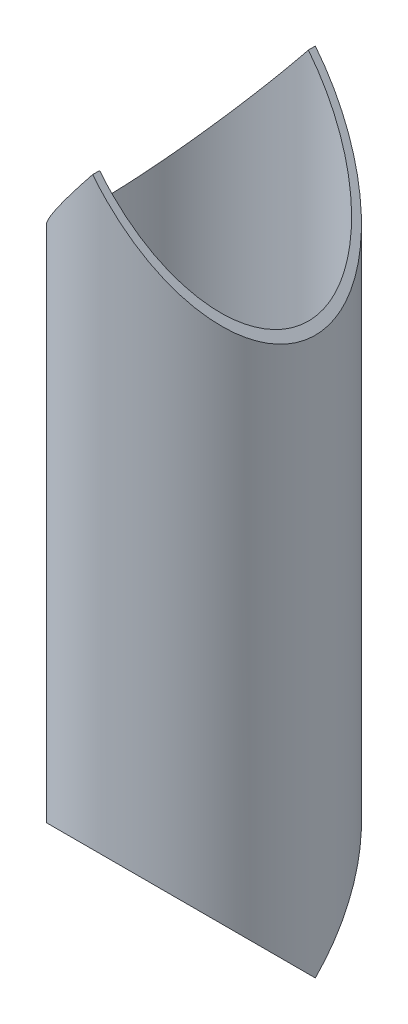
from build123d import *

# Parameters (mm, degrees)
SKETCH1_R               = 25.4
SKETCH1_R_2             = 23.8125
BOSS_EXTRUDE1_DEPTH     = 158.75
CUT_EXTRUDE1_DEPTH      = 163.763271348
CUT_EXTRUDE1_DEPTH_BACK = 163.763271348
CUT_EXTRUDE2_DEPTH      = 163.763271348
CUT_EXTRUDE2_DEPTH_BACK = 163.763271348


with BuildPart() as part:
    # Sketch1 → Boss-Extrude1 (new body)
    with BuildSketch(Plane(origin=(0, 0, 0), x_dir=(1, 0, 0), z_dir=(0, 1, 0))):
        with Locations(Location((0, 0, 0), (0, 0, 90))):
            Circle(SKETCH1_R)
        with Locations(Location((0, 0, 0), (0, 0, 90))):
            Circle(SKETCH1_R_2, mode=Mode.SUBTRACT)
    extrude(amount=BOSS_EXTRUDE1_DEPTH)

    # Sketch2 → Cut-Extrude1 (cut, two sides: drawn at the far end of the back side and taken through both)
    with BuildSketch(Plane.XY.offset(-CUT_EXTRUDE1_DEPTH_BACK)):
        Polygon((25.4, 127), (25.4, 158.75), (-0.960093291, 166.540490079), (-25.4, 158.75), (-25.4, 127), (0, 158.75), align=None)
    extrude(amount=CUT_EXTRUDE1_DEPTH + CUT_EXTRUDE1_DEPTH_BACK, mode=Mode.SUBTRACT)

    # Sketch3 → Cut-Extrude2 (cut, two sides: drawn at the far end of the back side and taken through both)
    with BuildSketch(Plane(origin=(0, 0, 0), x_dir=(0, 0, -1), z_dir=(1, 0, 0)).offset(-CUT_EXTRUDE2_DEPTH_BACK)):
        Polygon((-25.4, 25.4), (-25.4, 0), (0.032632353, -12.112837501), (25.4, 0), (25.4, 25.4), (0, 0), align=None)
    extrude(amount=CUT_EXTRUDE2_DEPTH + CUT_EXTRUDE2_DEPTH_BACK, mode=Mode.SUBTRACT)


solid = part.part
